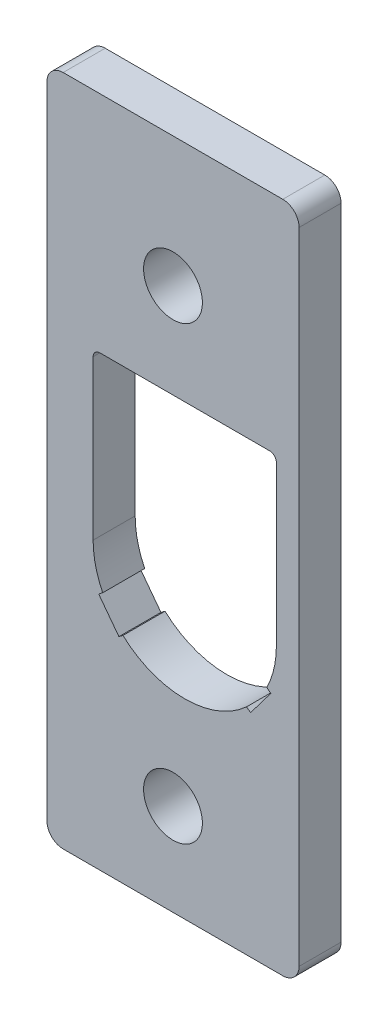
from build123d import *

# Parameters (mm, degrees)
SKETCH1_W           = 38.1
SKETCH1_H           = 101.6
BOSS_EXTRUDE1_DEPTH = 6.35
CUT_EXTRUDE1_REACH  = 64.822
SKETCH2_R           = 4.445
FILLET5_R           = 1.016
FILLET6_R           = 2.46


with BuildPart() as part:
    # Sketch1 → Boss-Extrude1 (new body)
    with BuildSketch(Plane.XY):
        with Locations((-1.778, 8.128)):
            Rectangle(SKETCH1_W, SKETCH1_H)
        with BuildLine():
            Line((-13.843, 25.019), (-13.843, 0))
            ThreePointArc((-13.843, 0), (-13.476504522, -3.164249495), (-12.396424133, -6.16095104))
            Line((-12.396424133, -6.16095104), (-13.004984391, -6.619534088))
            Line((-13.004984391, -6.619534088), (-9.947764074, -10.676602479))
            Line((-9.947764074, -10.676602479), (-9.339203815, -10.218019431))
            ThreePointArc((-9.339203815, -10.218019431), (0, -13.843), (9.339203815, -10.218019431))
            Line((9.339203815, -10.218019431), (9.947764074, -10.676602479))
            Line((9.947764074, -10.676602479), (13.004984391, -6.619534088))
            Line((13.004984391, -6.619534088), (12.396424133, -6.16095104))
            ThreePointArc((12.396424133, -6.16095104), (13.476504522, -3.164249495), (13.843, 0))
            Line((13.843, 0), (13.843, 25.019))
            Line((13.843, 25.019), (-13.843, 25.019))
        make_face(mode=Mode.SUBTRACT)
    extrude(amount=BOSS_EXTRUDE1_DEPTH)

    # Sketch2 → Cut-Extrude1 (cut, up to next)
    with BuildSketch(Plane.XY.offset(6.35), mode=Mode.PRIVATE) as cut_extrude1_sk1:
        with Locations((-1.778, 39.322375)):
            Circle(SKETCH2_R)
    cut_extrude1_tool1 = extrude(cut_extrude1_sk1.sketch, amount=-CUT_EXTRUDE1_REACH, mode=Mode.PRIVATE) & part.part
    # Sketch2 → Cut-Extrude1 (cut, up to next)
    with BuildSketch(Plane.XY.offset(6.35), mode=Mode.PRIVATE) as cut_extrude1_sk2:
        with Locations((-1.778, -28.781375)):
            Circle(SKETCH2_R)
    cut_extrude1_tool2 = extrude(cut_extrude1_sk2.sketch, amount=-CUT_EXTRUDE1_REACH, mode=Mode.PRIVATE) & part.part
    add(cut_extrude1_tool1.solids().sort_by_distance((-1.778, 39.322375, 6.35))[0], mode=Mode.SUBTRACT)
    add(cut_extrude1_tool2.solids().sort_by_distance((-1.778, -28.781375, 6.35))[0], mode=Mode.SUBTRACT)

    # Fillet5
    fillet5_edges = [part.edges().sort_by_distance(p)[0] for p in [
        (13.843, 25.019, 3.175),
        (-13.843, 25.019, 3.175),
    ]]
    fillet(fillet5_edges, radius=FILLET5_R)

    # Fillet6
    fillet6_edges = [part.edges().sort_by_distance(p)[0] for p in [
        (-20.828, 58.928, 3.175),
        (17.272, 58.928, 3.175),
        (17.272, -42.672, 3.175),
        (-20.828, -42.672, 3.175),
    ]]
    fillet(fillet6_edges, radius=FILLET6_R)


solid = part.part
